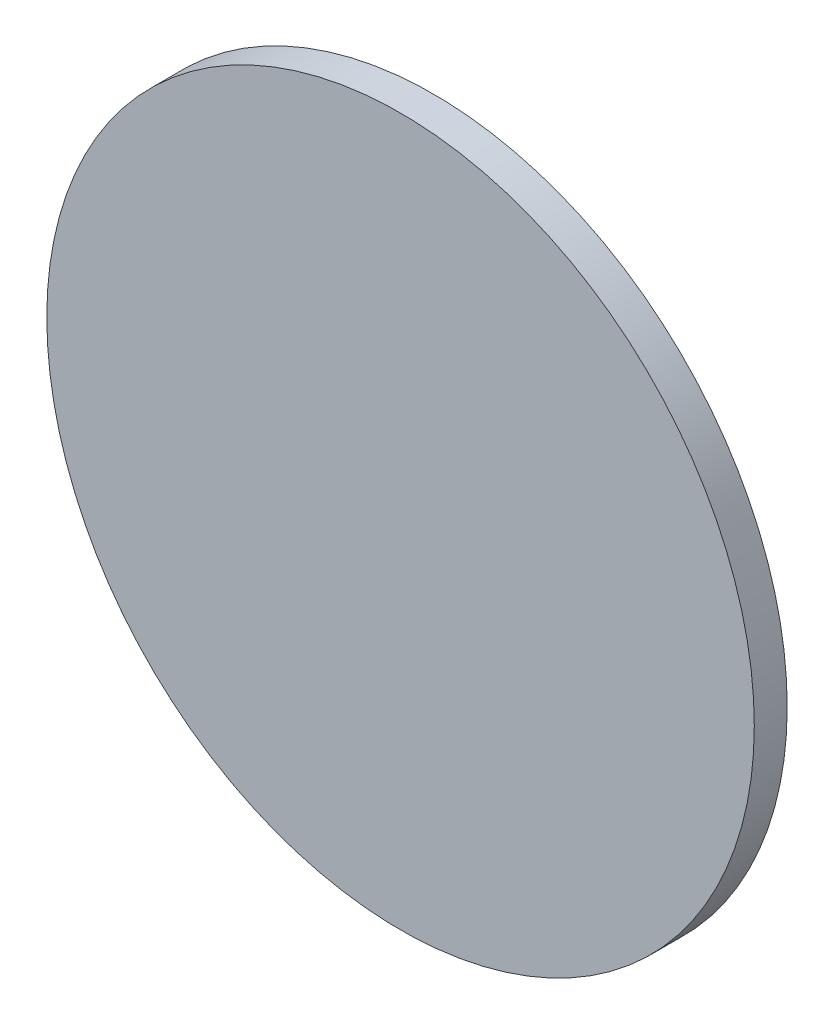
from build123d import *

# Parameters (mm, degrees)
SKETCH2_R           = 32.25
BOSS_EXTRUDE1_DEPTH = 3


with BuildPart() as part:
    # Sketch2 → Boss-Extrude1 (new body)
    with BuildSketch(Plane.XY):
        Circle(SKETCH2_R)
    extrude(amount=BOSS_EXTRUDE1_DEPTH)


solid = part.part
